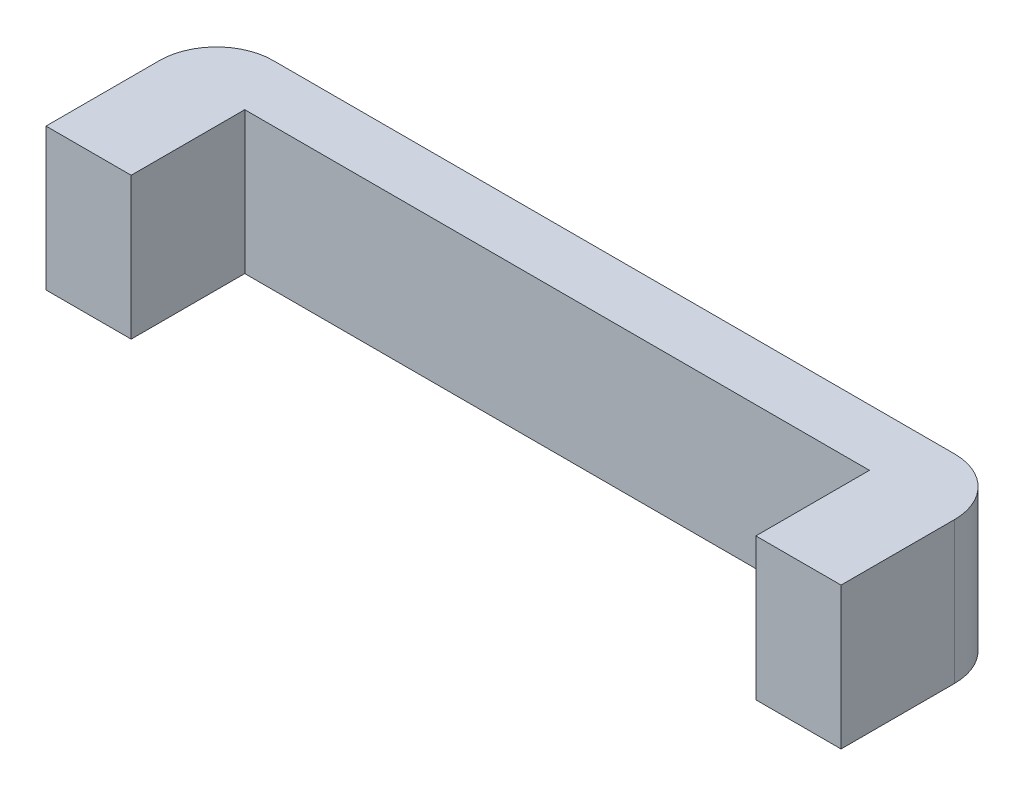
from build123d import *

# Parameters (mm, degrees)
SKETCH1_W           = 35.56
SKETCH1_H           = 7.62
BOSS_EXTRUDE1_DEPTH = 6.35
SKETCH2_W           = 27.94
SKETCH2_H           = 5.08
CUT_EXTRUDE1_DEPTH  = 37.917482309
FILLET1_R           = 2.54


with BuildPart() as part:
    # Sketch1 → Boss-Extrude1 (new body)
    with BuildSketch(Plane(origin=(0, 0, 0), x_dir=(1, 0, 0), z_dir=(0, 1, 0))):
        with Locations((17.78, -3.81)):
            Rectangle(SKETCH1_W, SKETCH1_H)
    extrude(amount=BOSS_EXTRUDE1_DEPTH)

    # Sketch2 → Cut-Extrude1 (cut, through all)
    with BuildSketch(Plane(origin=(0, 6.35, 0), x_dir=(1, 0, 0), z_dir=(0, 1, 0))):
        with Locations((17.78, -5.08)):
            Rectangle(SKETCH2_W, SKETCH2_H)
    extrude(amount=-CUT_EXTRUDE1_DEPTH, mode=Mode.SUBTRACT)

    # Fillet1
    fillet1_edges = [part.edges().sort_by_distance(p)[0] for p in [
        (0, 3.175, 0),
        (35.56, 3.175, 0),
    ]]
    fillet(fillet1_edges, radius=FILLET1_R)


solid = part.part
